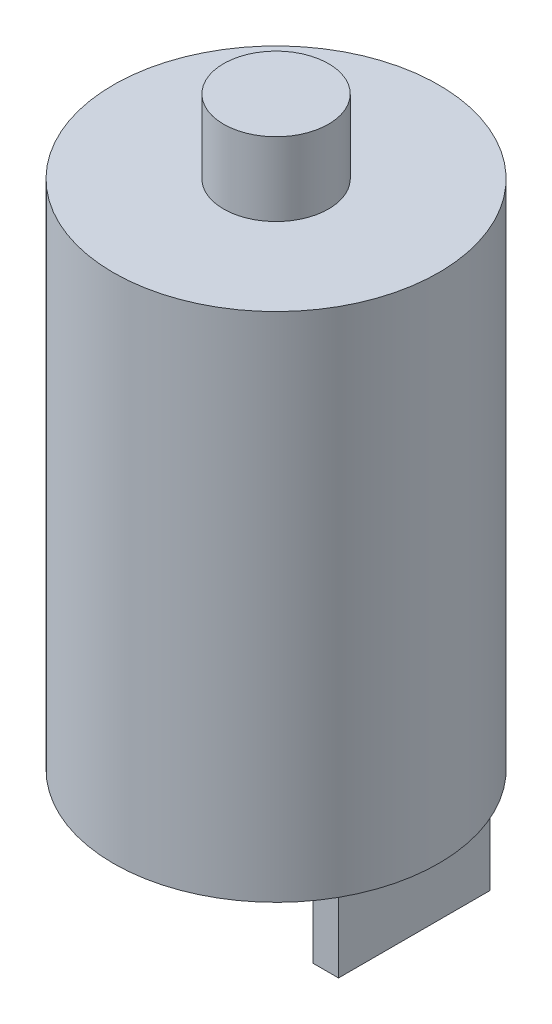
from build123d import *

# Parameters (mm, degrees)
SKETCH1_R           = 6.2
BOSS_EXTRUDE1_DEPTH = 19.5
SKETCH2_R           = 2
BOSS_EXTRUDE2_DEPTH = 2.8
SKETCH3_W           = 0.9633
SKETCH3_H           = 5.7798
BOSS_EXTRUDE3_DEPTH = 2.8


with BuildPart() as part:
    # Sketch1 → Boss-Extrude1 (new body)
    with BuildSketch(Plane(origin=(0, 0, 0), x_dir=(1, 0, 0), z_dir=(0, 1, 0))):
        with Locations(Location((0, 0, 0), (0, 0, 270))):
            Circle(SKETCH1_R)
    extrude(amount=BOSS_EXTRUDE1_DEPTH)

    # Sketch2 → Boss-Extrude2 (add)
    with BuildSketch(Plane(origin=(0, 19.5, 0), x_dir=(1, 0, 0), z_dir=(0, 1, 0))):
        with Locations(Location((0, 0, 0), (0, 0, 270))):
            Circle(SKETCH2_R)
    extrude(amount=BOSS_EXTRUDE2_DEPTH)

    # Sketch3 → Boss-Extrude3 (add)
    with BuildSketch(Plane.XZ):
        with Locations((4.78885, 0)):
            Rectangle(SKETCH3_W, SKETCH3_H)
        with Locations((-4.78885, 0)):
            Rectangle(SKETCH3_W, SKETCH3_H)
    extrude(amount=BOSS_EXTRUDE3_DEPTH)


solid = part.part
